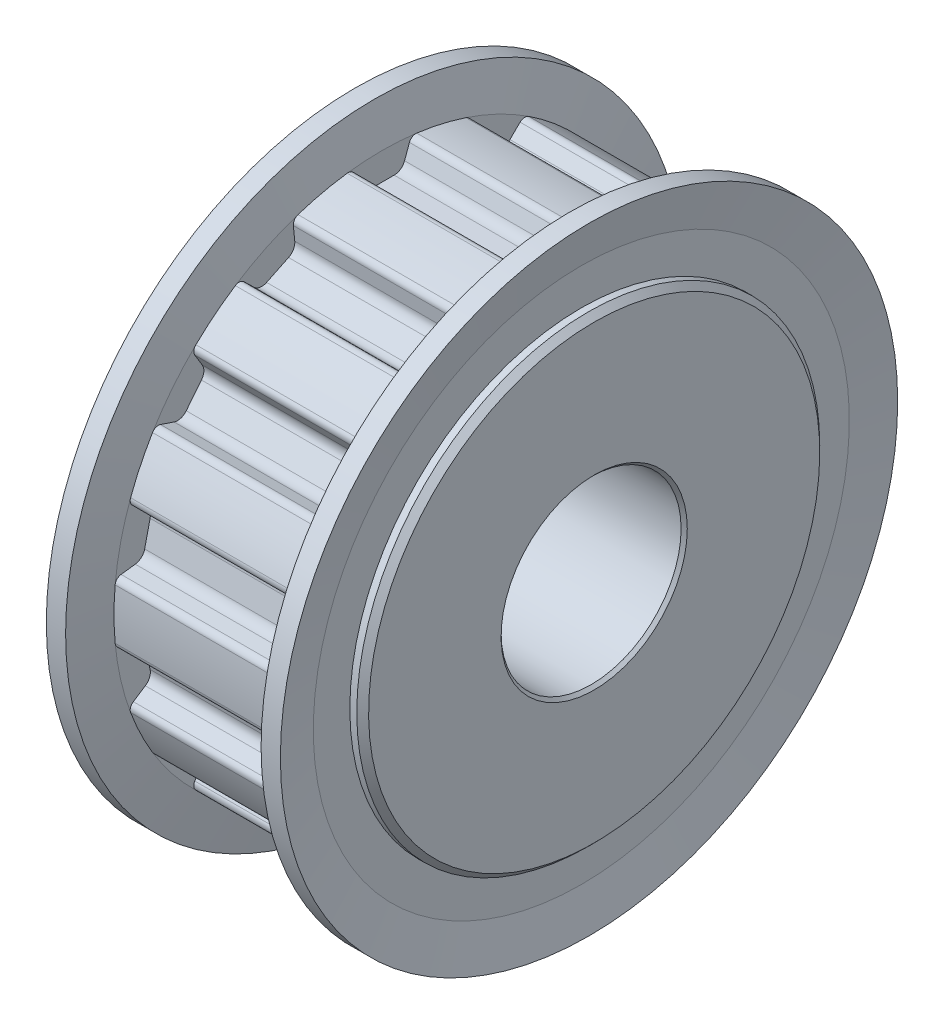
from build123d import *

# Parameters (mm, degrees)
CUT_EXTRUDE_START        = 16.5
CUT_EXTRUDE_1_DEPTH      = 14
PATTERN_CIRCULAR_1_COUNT = 14
SKETCH_6_R               = 7
CUT_EXTRUDE_2_DEPTH      = 39.897300678
CHAMFER_1_SIZE           = 0.24
SKETCH_8_W               = 4
SKETCH_8_H               = 9
SKETCH_8_3_W             = 4
SKETCH_8_3_H             = 9


with BuildPart() as part:
    # 草图3 → 旋转1 (revolve)
    with BuildSketch(Plane.XY):
        Polygon((0, 0), (0, 17.54), (0.46, 18), (2.5, 18), (2.5, 20.84), (16.5, 20.84), (16.5, 18), (18.54, 18), (19, 17.54), (19, 0), align=None)
    revolve(axis=Axis((19, 0, 0), (-1, 0, 0)))

    # 草图4 → Cut-Extrude 1 (cut)
    with BuildSketch(Plane(origin=(0, 0, 0), x_dir=(0, 0, -1), z_dir=(1, 0, 0)).offset(CUT_EXTRUDE_START)):
        with BuildLine():
            Line((-0.947821517, 18.71), (0.947821517, 18.71))
            ThreePointArc((0.947821517, 18.71), (1.441097252, 18.865529242), (1.755957171, 19.275862677))
            Line((1.755957171, 19.275862677), (2.135902122, 20.319752849))
            ThreePointArc((2.135902122, 20.319752849), (2.358797616, 20.591469041), (2.702673222, 20.664006326))
            ThreePointArc((2.702673222, 20.664006326), (0, 20.84), (-2.702673222, 20.664006326))
            ThreePointArc((-2.702673222, 20.664006326), (-2.358797616, 20.591469041), (-2.135902122, 20.319752849))
            Line((-2.135902122, 20.319752849), (-1.755957171, 19.275862677))
            ThreePointArc((-1.755957171, 19.275862677), (-1.441097252, 18.865529242), (-0.947821517, 18.71))
        make_face()
    cut_extrude_1 = extrude(amount=-CUT_EXTRUDE_1_DEPTH, mode=Mode.SUBTRACT)

    # 阵列(圆周)1: Cut-Extrude 1 ×14 about axis
    pattern_circular_1_axis = Axis((0, 0, 0), (1, 0, 0))
    for i in range(1, PATTERN_CIRCULAR_1_COUNT):
        add(cut_extrude_1.rotate(pattern_circular_1_axis, i * 360 / PATTERN_CIRCULAR_1_COUNT), mode=Mode.SUBTRACT)

    # 草图5 → 旋转2 (revolve)
    with BuildSketch(Plane.XY, mode=Mode.PRIVATE) as revolve_2_sk:
        Polygon((1.9, 24), (2.5, 20.84), (2.5, 18), (1, 18), (1, 20.84), (0.4, 24), align=None)
        Polygon((18, 18), (16.5, 18), (16.5, 20.84), (17.1, 24), (18.6, 24), (18, 20.84), align=None)
    revolve(revolve_2_sk.sketch.rotate(Axis((0, 0, 0), (1, 0, 0)), 180), axis=Axis((0, 0, 0), (1, 0, 0)))

    # 草图6 → 切除-拉伸2 (cut, through all)
    with BuildSketch(Plane(origin=(0, 0, 0), x_dir=(0, 0, -1), z_dir=(1, 0, 0))):
        Circle(SKETCH_6_R)
    extrude(amount=CUT_EXTRUDE_2_DEPTH, mode=Mode.SUBTRACT)

    # 倒角1
    chamfer_1_edges = [part.edges().sort_by_distance(p)[0] for p in [
        (0, 0, 7),
        (19, 0, 7),
    ]]
    chamfer(chamfer_1_edges, length=CHAMFER_1_SIZE)

    # 草图8 → 旋转3 (revolve)
    with BuildSketch(Plane.XY, mode=Mode.PRIVATE) as revolve_3_sk:
        with Locations((1, 4.5)):
            Rectangle(SKETCH_8_W, SKETCH_8_H)
    revolve(revolve_3_sk.sketch.rotate(Axis((-1, 0, 0), (1, 0, 0)), 90), axis=Axis((-1, 0, 0), (1, 0, 0)))

    # 草图8<3> → 切除-旋转4 (revolve, cut)
    with BuildSketch(Plane.XY, mode=Mode.PRIVATE) as cut_revolve_4_sk:
        with Locations((1, 4.5)):
            Rectangle(SKETCH_8_3_W, SKETCH_8_3_H)
    revolve(cut_revolve_4_sk.sketch.rotate(Axis((-1, 0, 0), (1, 0, 0)), 90), axis=Axis((-1, 0, 0), (1, 0, 0)), mode=Mode.SUBTRACT)


solid = part.part
